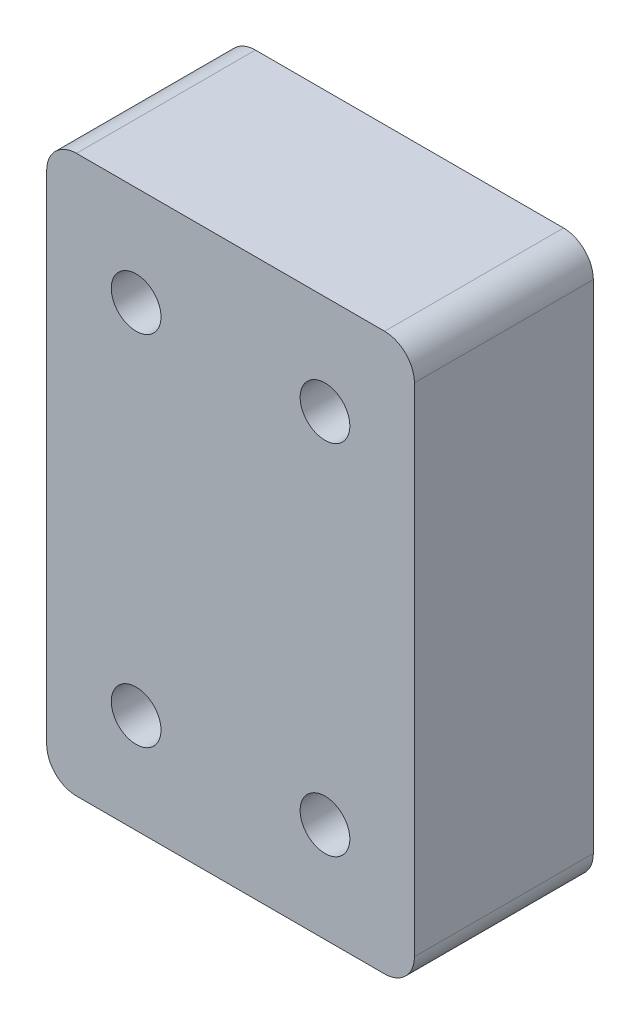
from build123d import *

# Parameters (mm, degrees)
BOSS_EXTRUDE1_DEPTH = 18
SKETCH2_R           = 2.5
CUT_EXTRUDE1_DEPTH  = 4


with BuildPart() as part:
    # Sketch1 → Boss-Extrude1 (new body)
    with BuildSketch(Plane.XY):
        with BuildLine():
            Line((-15.5, -28), (15.5, -28))
            ThreePointArc((15.5, -28), (17.621320344, -27.121320344), (18.5, -25))
            Line((18.5, -25), (18.5, 25))
            ThreePointArc((18.5, 25), (17.621320344, 27.121320344), (15.5, 28))
            Line((15.5, 28), (-15.5, 28))
            ThreePointArc((-15.5, 28), (-17.621320344, 27.121320344), (-18.5, 25))
            Line((-18.5, 25), (-18.5, -25))
            ThreePointArc((-18.5, -25), (-17.621320344, -27.121320344), (-15.5, -28))
        make_face()
    extrude(amount=BOSS_EXTRUDE1_DEPTH)

    # Sketch2 → Cut-Extrude1 (cut)
    with BuildSketch(Plane.XY.offset(18)):
        with Locations((-9.5, 18)):
            Circle(SKETCH2_R)
        with Locations((-9.5, -18)):
            Circle(SKETCH2_R)
        with Locations(Location((9.5, -18, 0), (0, 0, 180))):
            Circle(SKETCH2_R)
        with Locations(Location((9.5, 18, 0), (0, 0, 180))):
            Circle(SKETCH2_R)
    extrude(amount=-CUT_EXTRUDE1_DEPTH, mode=Mode.SUBTRACT)


solid = part.part
